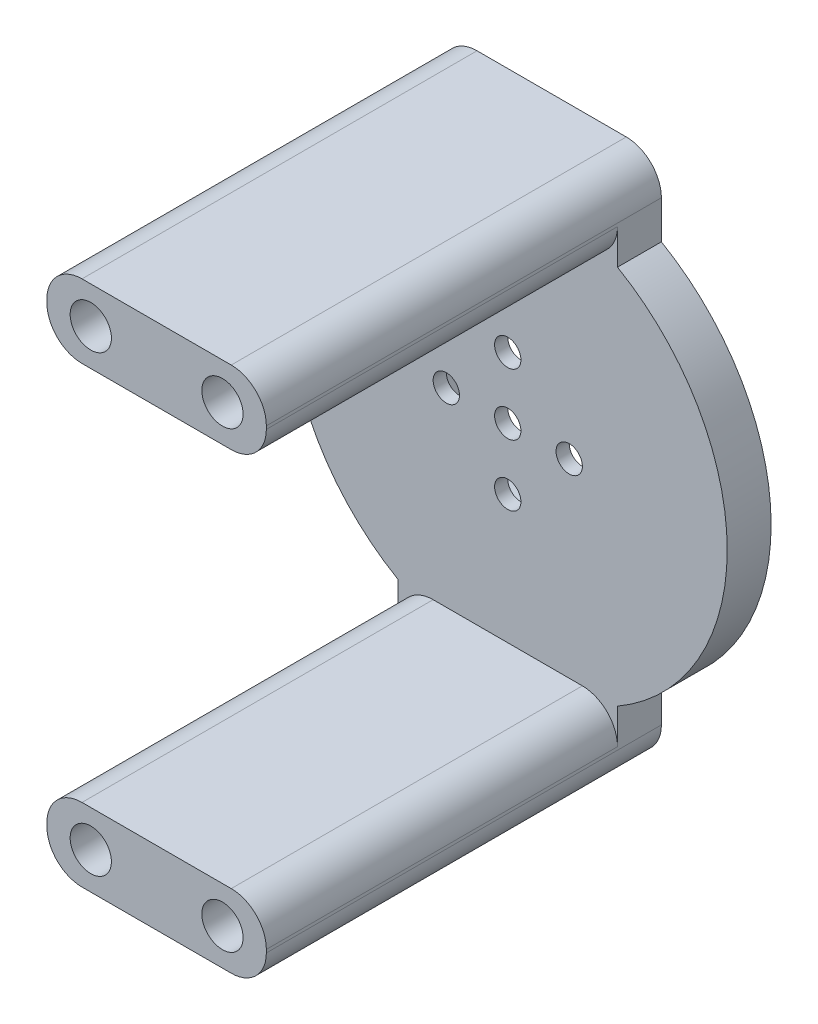
from build123d import *

# Parameters (mm, degrees)
SKETCH1_R           = 1.5
BOSS_EXTRUDE1_DEPTH = 5
SKETCH3_R           = 10.5
CUT_EXTRUDE2_DEPTH  = 3.5
SKETCH4_W           = 25
SKETCH4_H           = 8.349364905
BOSS_EXTRUDE2_DEPTH = 40
FILLET1_R           = 4
SKETCH5_R           = 2.35
CUT_EXTRUDE3_DEPTH  = 6


with BuildPart() as part:
    # Sketch1 → Boss-Extrude1 (new body)
    # profile 1 of 5: a face of its own
    with BuildSketch(Plane.XY):
        with BuildLine():
            ThreePointArc((-12.5, 21.650635095), (-25, 0), (-12.5, -21.650635095))
            Line((-12.5, -21.650635095), (-12.5, 21.650635095))
        make_face()
    # profile 2 of 5: a face of its own
    with BuildSketch(Plane.XY):
        with BuildLine():
            Line((-12.5, 21.650635095), (-12.5, -21.650635095))
            ThreePointArc((-12.5, -21.650635095), (0, -25), (12.5, -21.650635095))
            Line((12.5, -21.650635095), (12.5, 21.650635095))
            ThreePointArc((12.5, 21.650635095), (0, 25), (-12.5, 21.650635095))
        make_face()
        with Locations((0, -7)):
            Circle(SKETCH1_R, mode=Mode.SUBTRACT)
        with Locations((7, 0)):
            Circle(SKETCH1_R, mode=Mode.SUBTRACT)
        with Locations((-7, 0)):
            Circle(SKETCH1_R, mode=Mode.SUBTRACT)
        Circle(SKETCH1_R, mode=Mode.SUBTRACT)
        with Locations((0, 7)):
            Circle(SKETCH1_R, mode=Mode.SUBTRACT)
    # profile 3 of 5: a face of its own
    with BuildSketch(Plane.XY):
        with BuildLine():
            Line((-12.5, 30), (-12.5, 21.650635095))
            ThreePointArc((-12.5, 21.650635095), (0, 25), (12.5, 21.650635095))
            Line((12.5, 21.650635095), (12.5, 30))
            Line((12.5, 30), (-12.5, 30))
        make_face()
    # profile 4 of 5: a face of its own
    with BuildSketch(Plane.XY):
        with BuildLine():
            Line((-12.5, -21.650635095), (-12.5, -30))
            Line((-12.5, -30), (12.5, -30))
            Line((12.5, -30), (12.5, -21.650635095))
            ThreePointArc((12.5, -21.650635095), (0, -25), (-12.5, -21.650635095))
        make_face()
    # profile 5 of 5: a face of its own
    with BuildSketch(Plane.XY):
        with BuildLine():
            Line((12.5, 21.650635095), (12.5, -21.650635095))
            ThreePointArc((12.5, -21.650635095), (21.650635095, -12.5), (25, 0))
            ThreePointArc((25, 0), (21.650635095, 12.5), (12.5, 21.650635095))
        make_face()
    extrude(amount=BOSS_EXTRUDE1_DEPTH)

    # Sketch3 → Cut-Extrude2 (cut)
    with BuildSketch(Plane(origin=(0, 0, 0), x_dir=(-1, 0, 0), z_dir=(0, 0, -1))):
        Circle(SKETCH3_R)
    extrude(amount=-CUT_EXTRUDE2_DEPTH, mode=Mode.SUBTRACT)

    # Sketch4 → Boss-Extrude2 (add)
    with BuildSketch(Plane.XY.offset(5)):
        with Locations((0, 25.825317548)):
            Rectangle(SKETCH4_W, SKETCH4_H)
        with Locations((0, -25.825317548)):
            Rectangle(SKETCH4_W, SKETCH4_H)
    extrude(amount=BOSS_EXTRUDE2_DEPTH)

    # Fillet1
    fillet1_edges = [part.edges().sort_by_distance(p)[0] for p in [
        (-12.5, 30, 22.5),
        (12.5, 30, 22.5),
        (12.5, -30, 22.5),
        (-12.5, -30, 22.5),
        (-12.5, 21.650635095, 25),
        (12.5, 21.650635095, 25),
        (-12.5, -21.650635095, 25),
        (12.5, -21.650635095, 25),
    ]]
    fillet(fillet1_edges, radius=FILLET1_R)

    # Sketch5 → Cut-Extrude3 (cut)
    with BuildSketch(Plane.XY.offset(45)):
        with Locations((-7.5, 25.825317547)):
            Circle(SKETCH5_R)
        with Locations(Location((7.5, 25.825317547, 0), (0, 0, 180))):
            Circle(SKETCH5_R)
        with Locations((7.5, -25.825317547)):
            Circle(SKETCH5_R)
        with Locations(Location((-7.5, -25.825317547, 0), (0, 0, 180))):
            Circle(SKETCH5_R)
    extrude(amount=-CUT_EXTRUDE3_DEPTH, mode=Mode.SUBTRACT)


solid = part.part
